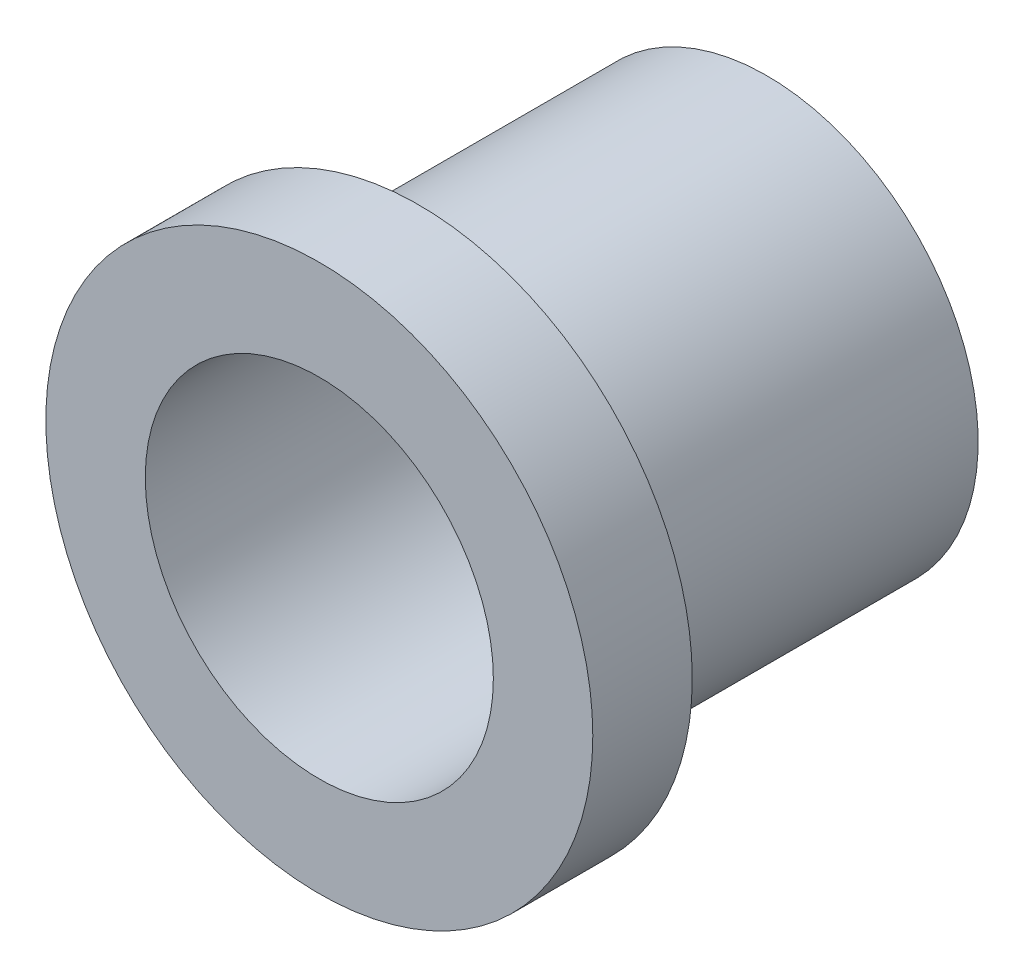
from build123d import *

# Parameters (mm, degrees)
SKETCH1_R           = 5.5
BOSS_EXTRUDE1_DEPTH = 2
SKETCH2_R           = 4.25
BOSS_EXTRUDE2_DEPTH = 7
SKETCH5_R           = 3.5
CUT_EXTRUDE3_DEPTH  = 8


with BuildPart() as part:
    # Sketch1 → Boss-Extrude1 (new body)
    with BuildSketch(Plane.XY):
        Circle(SKETCH1_R)
    extrude(amount=-BOSS_EXTRUDE1_DEPTH)

    # Sketch2 → Boss-Extrude2 (add)
    with BuildSketch(Plane(origin=(0, 0, -2), x_dir=(-1, 0, 0), z_dir=(0, 0, -1))):
        Circle(SKETCH2_R)
    extrude(amount=BOSS_EXTRUDE2_DEPTH)

    # Sketch5 → Cut-Extrude3 (cut)
    with BuildSketch(Plane.XY):
        Circle(SKETCH5_R)
    extrude(amount=-CUT_EXTRUDE3_DEPTH, mode=Mode.SUBTRACT)


solid = part.part
